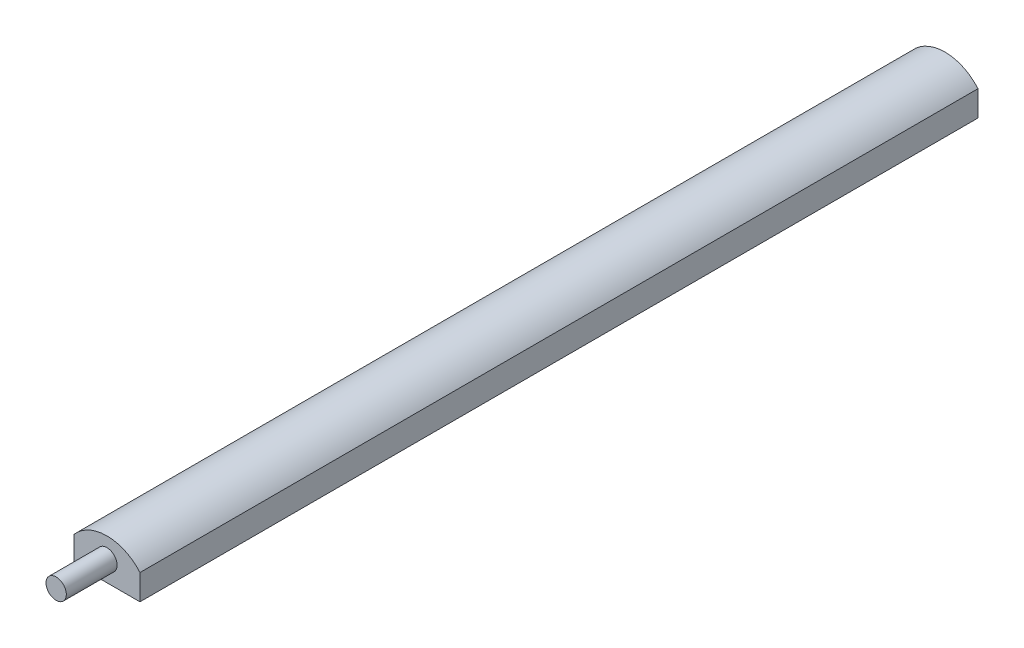
from build123d import *

# Parameters (mm, degrees)
BOSS_EXTRUDE1_DEPTH = 165
SKETCH2_R           = 2
BOSS_EXTRUDE2_DEPTH = 10


with BuildPart() as part:
    # Sketch1 → Boss-Extrude1 (new body)
    with BuildSketch(Plane.XY):
        with BuildLine():
            Line((0, 0), (13, 0))
            Line((13, 0), (13, 5))
            ThreePointArc((13, 5), (6.5, 8), (0, 5))
            Line((0, 5), (0, 0))
        make_face()
    extrude(amount=BOSS_EXTRUDE1_DEPTH)

    # Sketch2 → Boss-Extrude2 (add)
    with BuildSketch(Plane.XY.offset(165)):
        with Locations(Location((6.5, 4, 0), (0, 0, 180))):
            Circle(SKETCH2_R)
    extrude(amount=BOSS_EXTRUDE2_DEPTH)


solid = part.part
